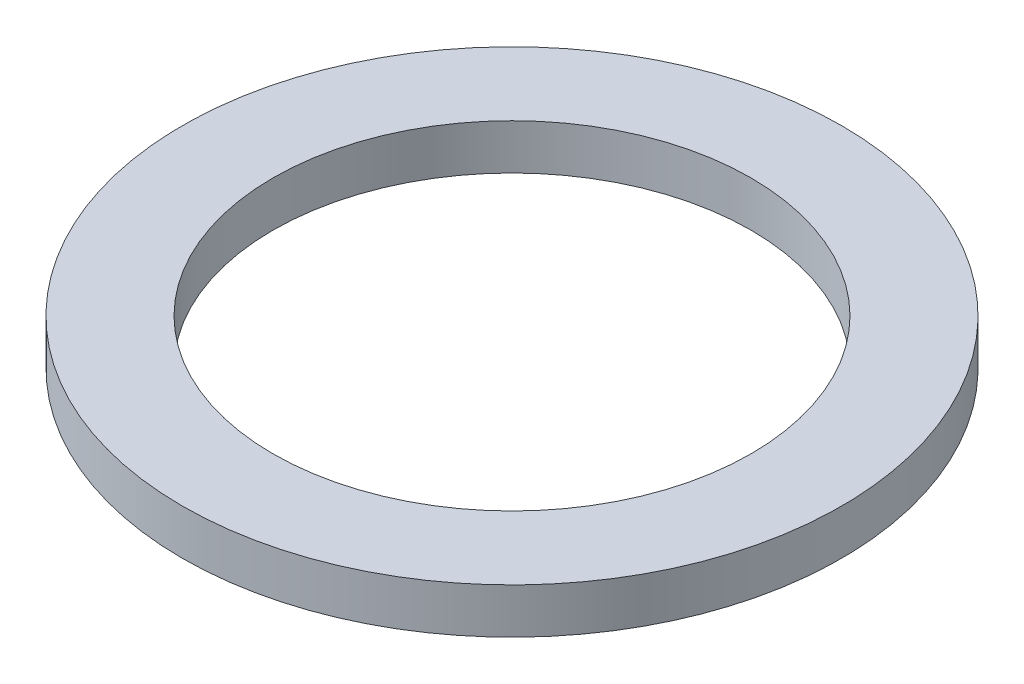
from build123d import *

# Parameters (mm, degrees)
PORON_W = 9.997961983
PORON_H = 5


with BuildPart() as part:
    # poron → Revolve1 (revolve)
    with BuildSketch(Plane(origin=(0, 0, 0), x_dir=(0, 0, -1), z_dir=(1, 0, 0))):
        with Locations((31.386737192, 271.477978152)):
            Rectangle(PORON_W, PORON_H)
    revolve(axis=Axis((0, 0, 0), (0, 1, 0)))


solid = part.part
